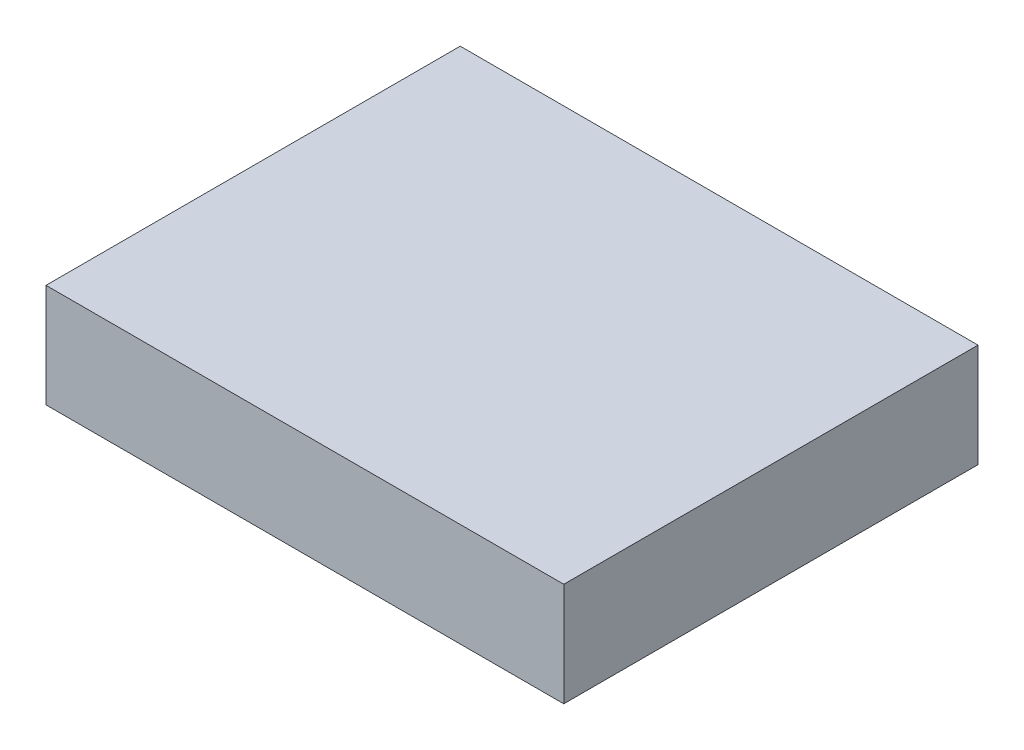
from build123d import *

# Parameters (mm, degrees)
SKETCH1_W           = 50
SKETCH1_H           = 40
BOSS_EXTRUDE1_DEPTH = 10


with BuildPart() as part:
    # Sketch1 → Boss-Extrude1 (new body)
    with BuildSketch(Plane(origin=(0, 0, 0), x_dir=(1, 0, 0), z_dir=(0, 1, 0))):
        Rectangle(SKETCH1_W, SKETCH1_H)
    extrude(amount=BOSS_EXTRUDE1_DEPTH)


solid = part.part
